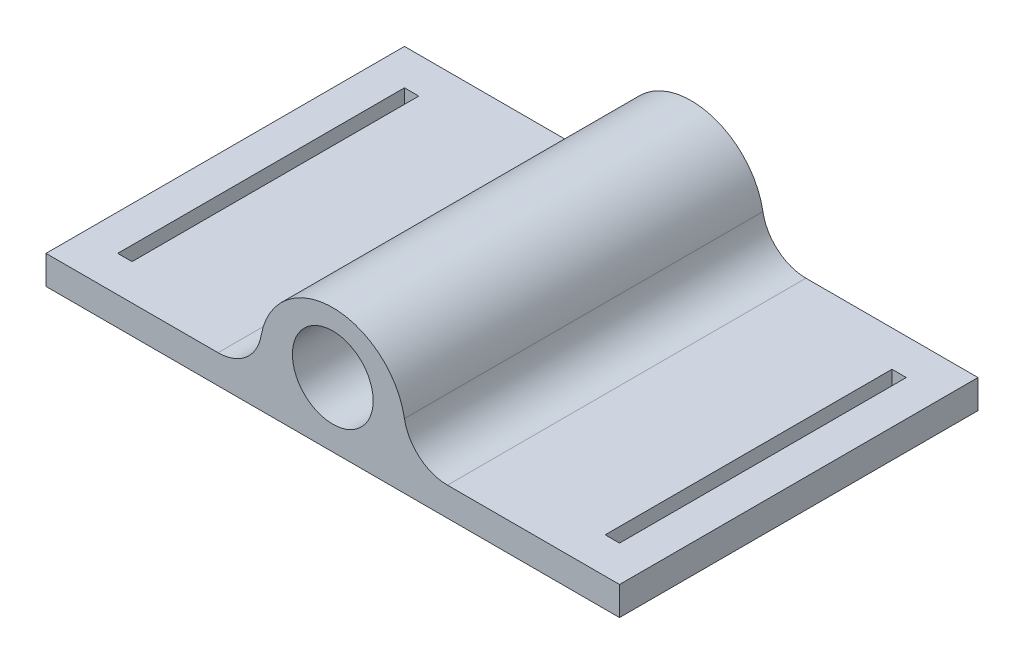
from build123d import *

# Parameters (mm, degrees)
BOSS_EXTRUDE2_DEPTH = 25
SKETCH3_W           = 1
SKETCH3_H           = 20
CUT_EXTRUDE2_DEPTH  = 5
SKETCH4_R           = 2.817174782
CUT_EXTRUDE3_DEPTH  = 36


with BuildPart() as part:
    # Sketch1 → Boss-Extrude2 (new body)
    with BuildSketch(Plane.XY):
        with BuildLine():
            Line((-4.122666018, 0), (-4.122666018, 2))
            Line((-4.122666018, 2), (7.877333982, 2))
            ThreePointArc((7.877333982, 2), (9.83688299, 2.714187595), (10.877333982, 4.521771056))
            ThreePointArc((10.877333982, 4.521771056), (15.877333982, 8.724722816), (20.877333982, 4.521771056))
            ThreePointArc((20.877333982, 4.521771056), (21.917784974, 2.714187595), (23.877333982, 2))
            Line((23.877333982, 2), (35.877333982, 2))
            Line((35.877333982, 2), (35.877333982, 0))
            Line((35.877333982, 0), (-4.122666018, 0))
        make_face()
    extrude(amount=BOSS_EXTRUDE2_DEPTH)

    # Sketch3 → Cut-Extrude2 (cut)
    with BuildSketch(Plane(origin=(0, 0, 0), x_dir=(1, 0, 0), z_dir=(0, 1, 0))):
        with Locations((-1.122666018, -12.5)):
            Rectangle(SKETCH3_W, SKETCH3_H)
        with Locations((32.877333982, -12.5)):
            Rectangle(SKETCH3_W, SKETCH3_H)
    extrude(amount=CUT_EXTRUDE2_DEPTH, mode=Mode.SUBTRACT)

    # Sketch4 → Cut-Extrude3 (cut)
    with BuildSketch(Plane.XY.offset(25)):
        with Locations((15.877333982, 4.5)):
            Circle(SKETCH4_R)
    extrude(amount=-CUT_EXTRUDE3_DEPTH, mode=Mode.SUBTRACT)


solid = part.part
